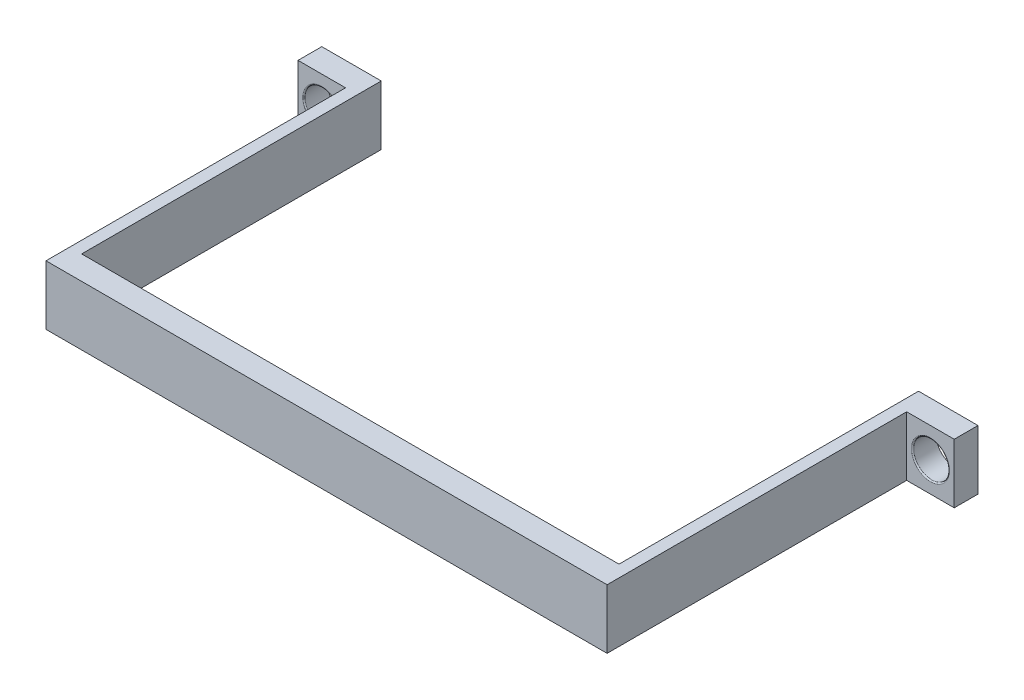
from build123d import *

# Parameters (mm, degrees)
SKETCH10_W          = 50.2
SKETCH10_H          = 5
BOSS_EXTRUDE5_DEPTH = 27.2
SKETCH15_W          = 45.2
SKETCH15_H          = 25.2
CUT_EXTRUDE7_DEPTH  = 48.330596764
SKETCH16_W          = 1.5
SKETCH16_H          = 5
CUT_EXTRUDE8_DEPTH  = 25.2
SKETCH17_W          = 1.5
SKETCH17_H          = 5
CUT_EXTRUDE9_DEPTH  = 25.2
SKETCH19_W          = 2
SKETCH19_H          = 5
BOSS_EXTRUDE6_DEPTH = 2.5
SKETCH20_W          = 2
SKETCH20_H          = 5
BOSS_EXTRUDE7_DEPTH = 2.5
SKETCH21_R          = 1.5
CUT_EXTRUDE10_DEPTH = 2.5
FILLET4_R           = 0.1
SKETCH22_R          = 1.5
CUT_EXTRUDE11_DEPTH = 2.5
FILLET5_R           = 0.1


with BuildPart() as part:
    # Sketch10 → Boss-Extrude5 (new body)
    with BuildSketch(Plane.XY):
        with Locations((-13.310225071, -72.576377738)):
            Rectangle(SKETCH10_W, SKETCH10_H)
    extrude(amount=BOSS_EXTRUDE5_DEPTH)

    # Sketch15 → Cut-Extrude7 (cut, through all)
    with BuildSketch(Plane(origin=(0, -75.076377738, 0), x_dir=(-1, 0, 0), z_dir=(0, -1, 0))):
        with Locations((13.310225071, -12.6)):
            Rectangle(SKETCH15_W, SKETCH15_H)
    extrude(amount=-CUT_EXTRUDE7_DEPTH, mode=Mode.SUBTRACT)

    # Sketch16 → Cut-Extrude8 (cut)
    with BuildSketch(Plane.XY.offset(27.2)):
        with Locations((-37.660225071, -72.576377738)):
            Rectangle(SKETCH16_W, SKETCH16_H)
    extrude(amount=-CUT_EXTRUDE8_DEPTH, mode=Mode.SUBTRACT)

    # Sketch17 → Cut-Extrude9 (cut)
    with BuildSketch(Plane.XY.offset(27.2)):
        with Locations((11.039774929, -72.576377738)):
            Rectangle(SKETCH17_W, SKETCH17_H)
    extrude(amount=-CUT_EXTRUDE9_DEPTH, mode=Mode.SUBTRACT)

    # Sketch19 → Boss-Extrude6 (add)
    with BuildSketch(Plane.ZY.offset(38.410225071)):
        with Locations((1, -72.576377738)):
            Rectangle(SKETCH19_W, SKETCH19_H)
    extrude(amount=BOSS_EXTRUDE6_DEPTH)

    # Sketch20 → Boss-Extrude7 (add)
    with BuildSketch(Plane(origin=(11.789774929, 0, 0), x_dir=(0, 0, -1), z_dir=(1, 0, 0))):
        with Locations((-1, -72.576377738)):
            Rectangle(SKETCH20_W, SKETCH20_H)
    extrude(amount=BOSS_EXTRUDE7_DEPTH)

    # Sketch21 → Cut-Extrude10 (cut)
    with BuildSketch(Plane.XY.offset(2)):
        with Locations((-38.910225071, -72.576377738)):
            Circle(SKETCH21_R)
    extrude(amount=-CUT_EXTRUDE10_DEPTH, mode=Mode.SUBTRACT)

    # Fillet4
    fillet4_edges = [part.edges().sort_by_distance(p)[0] for p in [
        (-40.410225071, -72.576377738, 2),
    ]]
    fillet(fillet4_edges, radius=FILLET4_R)

    # Sketch22 → Cut-Extrude11 (cut)
    with BuildSketch(Plane.XY.offset(2)):
        with Locations((12.289774929, -72.576377738)):
            Circle(SKETCH22_R)
    extrude(amount=-CUT_EXTRUDE11_DEPTH, mode=Mode.SUBTRACT)

    # Fillet5
    fillet5_edges = [part.edges().sort_by_distance(p)[0] for p in [
        (10.789774929, -72.576377738, 2),
    ]]
    fillet(fillet5_edges, radius=FILLET5_R)


solid = part.part
